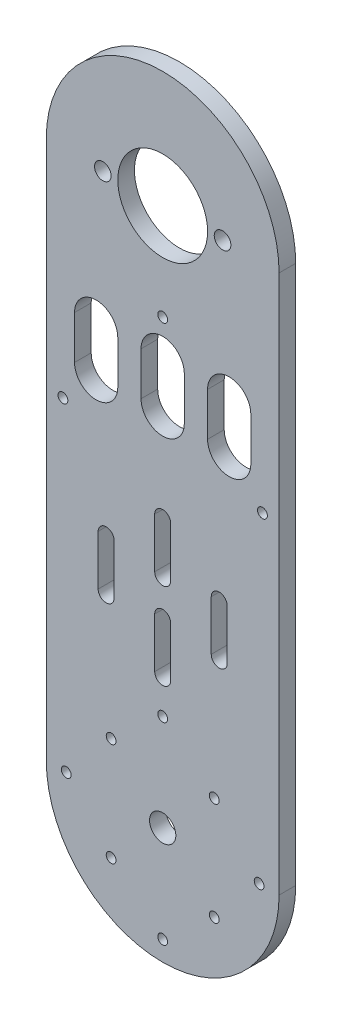
from build123d import *

# Parameters (mm, degrees)
SKETCH1_R           = 3.95
SKETCH1_R_2         = 1.475
SKETCH1_R_3         = 13.5
SKETCH1_R_4         = 2.5
BOSS_EXTRUDE1_DEPTH = 5


with BuildPart() as part:
    # Sketch1 → Boss-Extrude1 (new body)
    with BuildSketch(Plane.XY):
        with BuildLine():
            Line((35, 0), (35, 162))
            ThreePointArc((35, 162), (0, 197), (-35, 162))
            Line((-35, 162), (-35, 0))
            ThreePointArc((-35, 0), (0, -35), (35, 0))
        make_face()
        Circle(SKETCH1_R, mode=Mode.SUBTRACT)
        with Locations((15.5, 15.5)):
            Circle(SKETCH1_R_2, mode=Mode.SUBTRACT)
        with Locations((15.5, -15.5)):
            Circle(SKETCH1_R_2, mode=Mode.SUBTRACT)
        with Locations((-15.5, -15.5)):
            Circle(SKETCH1_R_2, mode=Mode.SUBTRACT)
        with Locations((-15.5, 15.5)):
            Circle(SKETCH1_R_2, mode=Mode.SUBTRACT)
        with Locations((0, 29)):
            Circle(SKETCH1_R_2, mode=Mode.SUBTRACT)
        with Locations((0, 162)):
            Circle(SKETCH1_R_3, mode=Mode.SUBTRACT)
        with Locations((-18, 162)):
            Circle(SKETCH1_R_4, mode=Mode.SUBTRACT)
        with Locations(Location((18, 162, 0), (0, 0, 180))):
            Circle(SKETCH1_R_4, mode=Mode.SUBTRACT)
        with Locations((0, 133)):
            Circle(SKETCH1_R_2, mode=Mode.SUBTRACT)
        with Locations((-30, 97)):
            Circle(SKETCH1_R_2, mode=Mode.SUBTRACT)
        with Locations(Location((30, 97, 0), (0, 0, 180))):
            Circle(SKETCH1_R_2, mode=Mode.SUBTRACT)
        with Locations((29, 0)):
            Circle(SKETCH1_R_2, mode=Mode.SUBTRACT)
        with Locations((0, -29)):
            Circle(SKETCH1_R_2, mode=Mode.SUBTRACT)
        with Locations((-29, 0)):
            Circle(SKETCH1_R_2, mode=Mode.SUBTRACT)
        with BuildLine():
            Line((2.4, 54.5), (2.4, 39.5))
            ThreePointArc((2.4, 39.5), (0, 37.1), (-2.4, 39.5))
            Line((-2.4, 39.5), (-2.4, 54.5))
            ThreePointArc((-2.4, 54.5), (0, 56.9), (2.4, 54.5))
        make_face(mode=Mode.SUBTRACT)
        with BuildLine():
            Line((2.4, 80.5), (2.4, 65.5))
            ThreePointArc((2.4, 65.5), (0, 63.1), (-2.4, 65.5))
            Line((-2.4, 65.5), (-2.4, 80.5))
            ThreePointArc((-2.4, 80.5), (0, 82.9), (2.4, 80.5))
        make_face(mode=Mode.SUBTRACT)
        with BuildLine():
            Line((19.4, 67.5), (19.4, 52.5))
            ThreePointArc((19.4, 52.5), (17, 50.1), (14.6, 52.5))
            Line((14.6, 52.5), (14.6, 67.5))
            ThreePointArc((14.6, 67.5), (17, 69.9), (19.4, 67.5))
        make_face(mode=Mode.SUBTRACT)
        with BuildLine():
            Line((-19.4, 67.5), (-19.4, 52.5))
            ThreePointArc((-19.4, 52.5), (-17, 50.1), (-14.6, 52.5))
            Line((-14.6, 52.5), (-14.6, 67.5))
            ThreePointArc((-14.6, 67.5), (-17, 69.9), (-19.4, 67.5))
        make_face(mode=Mode.SUBTRACT)
        with BuildLine():
            Line((6.5, 121.5), (6.5, 108.5))
            ThreePointArc((6.5, 108.5), (0, 102), (-6.5, 108.5))
            Line((-6.5, 108.5), (-6.5, 121.5))
            ThreePointArc((-6.5, 121.5), (0, 128), (6.5, 121.5))
        make_face(mode=Mode.SUBTRACT)
        with BuildLine():
            Line((26.5, 120.946496324), (26.5, 107.946496324))
            ThreePointArc((26.5, 107.946496324), (20, 101.446496324), (13.5, 107.946496324))
            Line((13.5, 107.946496324), (13.5, 120.946496324))
            ThreePointArc((13.5, 120.946496324), (20, 127.446496324), (26.5, 120.946496324))
        make_face(mode=Mode.SUBTRACT)
        with BuildLine():
            Line((-26.5, 120.946496324), (-26.5, 107.946496324))
            ThreePointArc((-26.5, 107.946496324), (-20, 101.446496324), (-13.5, 107.946496324))
            Line((-13.5, 107.946496324), (-13.5, 120.946496324))
            ThreePointArc((-13.5, 120.946496324), (-20, 127.446496324), (-26.5, 120.946496324))
        make_face(mode=Mode.SUBTRACT)
    extrude(amount=BOSS_EXTRUDE1_DEPTH)


solid = part.part
